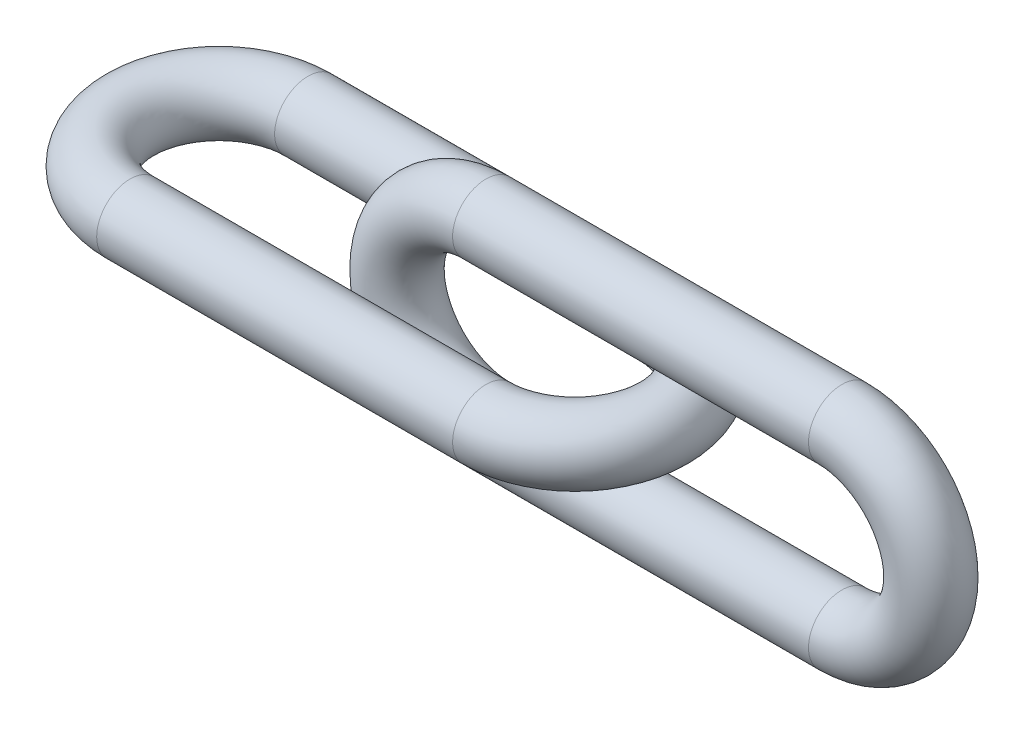
from build123d import *

# Parameters (mm, degrees)
SWEEP4_PROFILE_R = 3.75
SWEEP5_PROFILE_R = 3.75


with BuildPart() as part:
    # Sweep4: sweep along a path in Sketch1
    with BuildLine(Plane.XY) as sweep4_path:
        Line((0, 10), (40, 10))
        ThreePointArc((40, 10), (50, 0), (40, -10))
        Line((40, -10), (0, -10))
        ThreePointArc((0, -10), (-10, 0), (0, 10))
    # Sweep4 profile (on start of the path) → Sweep4 (sweep)
    with BuildSketch(Plane(origin=(0, 10, 0), x_dir=(0, 0, 1), z_dir=(1, 0, 0))):
        Circle(SWEEP4_PROFILE_R)
    sweep(path=sweep4_path.line)


with BuildPart() as body_2:
    # Sweep5: sweep along a path in Sketch12
    with BuildLine(Plane(origin=(0, 0, 0), x_dir=(1, 0, 0), z_dir=(0, 1, 0))) as sweep5_path:
        Line((-30, 10), (10, 10))
        ThreePointArc((10, 10), (20, 0), (10, -10))
        Line((10, -10), (-30, -10))
        ThreePointArc((-30, -10), (-40, 0), (-30, 10))
    # Sweep5 profile (on start of the path) → Sweep5 (sweep)
    with BuildSketch(Plane(origin=(-30, 0, -10), x_dir=(0, 0, 1), z_dir=(1, 0, 0))):
        Circle(SWEEP5_PROFILE_R)
    sweep(path=sweep5_path.line)


solid = Compound([part.part, body_2.part])
